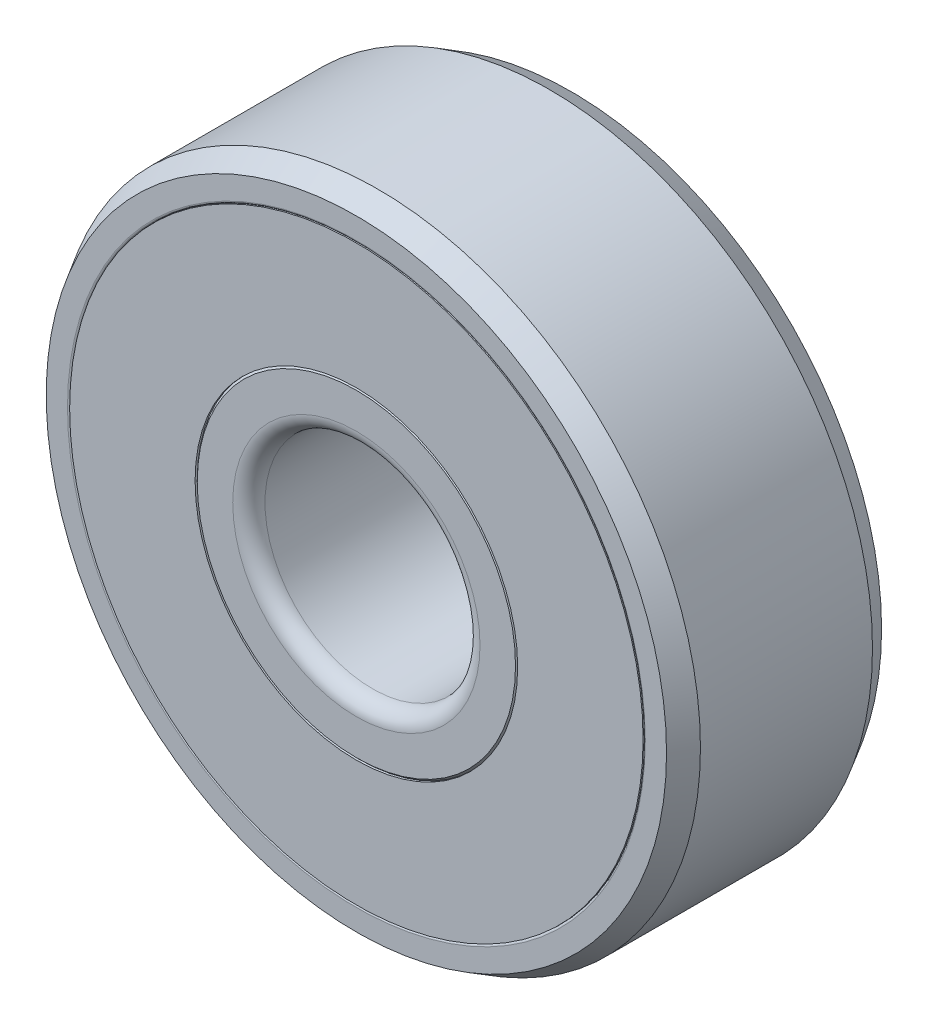
from build123d import *

# Parameters (mm, degrees)
SKETCH4_W         = 0.291666667
SKETCH4_H         = 2.333333333
CIRPATTERN1_COUNT = 7


with BuildPart() as part:
    # Sketch3 → Revolve1 (revolve)
    with BuildSketch(Plane(origin=(0, 0, 0), x_dir=(0, 0, -1), z_dir=(1, 0, 0)), mode=Mode.PRIVATE) as revolve1_sk:
        with BuildLine():
            Line((-1.6, -6), (1.6, -6))
            Line((1.6, -6), (2, -5.769059892))
            Line((2, -5.769059892), (2, -5.373333333))
            ThreePointArc((2, -5.373333333), (1.988284271, -5.345049062), (1.96, -5.333333333))
            Line((1.96, -5.333333333), (1.111111111, -5.333333333))
            ThreePointArc((1.111111111, -5.333333333), (0, -5.777777778), (-1.111111111, -5.333333333))
            Line((-1.111111111, -5.333333333), (-1.96, -5.333333333))
            ThreePointArc((-1.96, -5.333333333), (-1.988284271, -5.345049062), (-2, -5.373333333))
            Line((-2, -5.373333333), (-2, -5.769059892))
            Line((-2, -5.769059892), (-1.6, -6))
        make_face()
        with BuildLine():
            Line((-1.7, -2), (1.7, -2))
            ThreePointArc((1.7, -2), (1.912132034, -2.087867966), (2, -2.3))
            Line((2, -2.3), (2, -2.96))
            Line((2, -2.96), (1.96, -3))
            Line((1.96, -3), (1.111111111, -3))
            ThreePointArc((1.111111111, -3), (0, -2.555555556), (-1.111111111, -3))
            Line((-1.111111111, -3), (-1.96, -3))
            Line((-1.96, -3), (-2, -2.96))
            Line((-2, -2.96), (-2, -2.3))
            ThreePointArc((-2, -2.3), (-1.912132034, -2.087867966), (-1.7, -2))
        make_face()
    revolve(revolve1_sk.sketch.rotate(Axis((0, 0, 2), (0, 0, -1)), 270), axis=Axis((0, 0, 2), (0, 0, -1)))


with BuildPart() as body_2:
    # Sketch4 → Revolve2 (revolve)
    with BuildSketch(Plane(origin=(0, 0, 0), x_dir=(0, 0, -1), z_dir=(1, 0, 0)), mode=Mode.PRIVATE) as revolve2_sk:
        with Locations((-1.854166667, -4.166666667)):
            Rectangle(SKETCH4_W, SKETCH4_H)
    revolve(revolve2_sk.sketch.rotate(Axis((0, 0, 2), (0, 0, -1)), 270), axis=Axis((0, 0, 2), (0, 0, -1)))


with BuildPart() as body_3:
    # Sketch5 → Revolve3 (revolve)
    with BuildSketch(Plane(origin=(0, 0, 0), x_dir=(0, 0, -1), z_dir=(1, 0, 0))):
        with BuildLine():
            Line((0, -2.555555556), (0, -5.777777778))
            ThreePointArc((0, -5.777777778), (-1.611111111, -4.166666667), (0, -2.555555556))
        make_face()
    revolve(axis=Axis((0, 0, 0), (0, -1, 0)))


with BuildPart() as cirpattern1_1:
    # CirPattern1: pattern copy
    add(body_3.part.rotate(Axis((0, 0, 0), (0, 0, 1)), 1 * 360 / CIRPATTERN1_COUNT))


with BuildPart() as cirpattern1_2:
    # CirPattern1: pattern copy
    add(body_3.part.rotate(Axis((0, 0, 0), (0, 0, 1)), 2 * 360 / CIRPATTERN1_COUNT))


with BuildPart() as cirpattern1_3:
    # CirPattern1: pattern copy
    add(body_3.part.rotate(Axis((0, 0, 0), (0, 0, 1)), 3 * 360 / CIRPATTERN1_COUNT))


with BuildPart() as cirpattern1_4:
    # CirPattern1: pattern copy
    add(body_3.part.rotate(Axis((0, 0, 0), (0, 0, 1)), 4 * 360 / CIRPATTERN1_COUNT))


with BuildPart() as cirpattern1_5:
    # CirPattern1: pattern copy
    add(body_3.part.rotate(Axis((0, 0, 0), (0, 0, 1)), 5 * 360 / CIRPATTERN1_COUNT))


with BuildPart() as cirpattern1_6:
    # CirPattern1: pattern copy
    add(body_3.part.rotate(Axis((0, 0, 0), (0, 0, 1)), 6 * 360 / CIRPATTERN1_COUNT))


solid = Compound([part.part, body_2.part, body_3.part, cirpattern1_1.part, cirpattern1_2.part, cirpattern1_3.part, cirpattern1_4.part, cirpattern1_5.part, cirpattern1_6.part])
